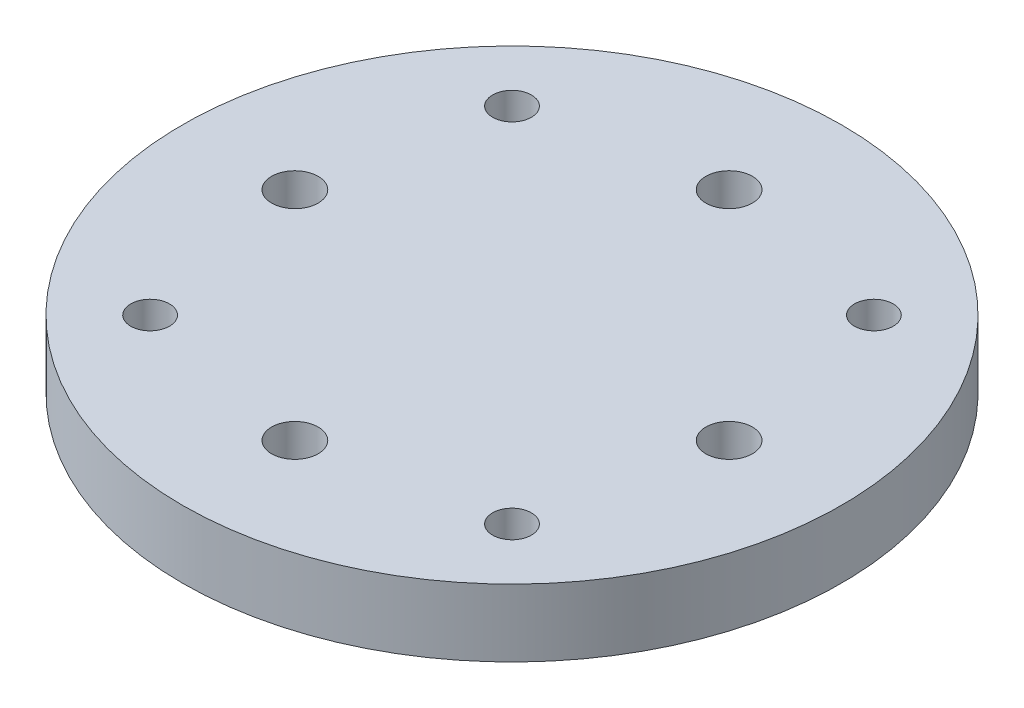
from build123d import *

# Parameters (mm, degrees)
SKETCH_1_R          = 42.5
EXTRUDE_1_DEPTH     = 8.7
SKETCH_2_R          = 3
SKETCH_2_R_2        = 2.5
CUT_EXTRUDE_2_DEPTH = 8.7


with BuildPart() as part:
    # Эскиз1 → Вытянуть1 (new body)
    with BuildSketch(Plane(origin=(0, 0, 0), x_dir=(1, 0, 0), z_dir=(0, 1, 0))):
        with Locations(Location((0, 0, 0), (0, 0, 270))):
            Circle(SKETCH_1_R)
    extrude(amount=EXTRUDE_1_DEPTH)

    # Эскиз2 → Вытянуть2 (cut)
    with BuildSketch(Plane(origin=(0, 8.7, 0), x_dir=(1, 0, 0), z_dir=(0, 1, 0))):
        with Locations(Location((0, 28, 0), (0, 0, 270))):
            Circle(SKETCH_2_R)
        with Locations(Location((28, 0, 0), (0, 0, 270))):
            Circle(SKETCH_2_R)
        with Locations(Location((0, -28, 0), (0, 0, 270))):
            Circle(SKETCH_2_R)
        with Locations(Location((-28, 0, 0), (0, 0, 270))):
            Circle(SKETCH_2_R)
        with Locations(Location((-23.334523779, 23.334523779, 0), (0, 0, 270))):
            Circle(SKETCH_2_R_2)
        with Locations(Location((23.334523779, 23.334523779, 0), (0, 0, 270))):
            Circle(SKETCH_2_R_2)
        with Locations(Location((23.334523779, -23.334523779, 0), (0, 0, 270))):
            Circle(SKETCH_2_R_2)
        with Locations(Location((-23.334523779, -23.334523779, 0), (0, 0, 270))):
            Circle(SKETCH_2_R_2)
    extrude(amount=-CUT_EXTRUDE_2_DEPTH, mode=Mode.SUBTRACT)


solid = part.part
